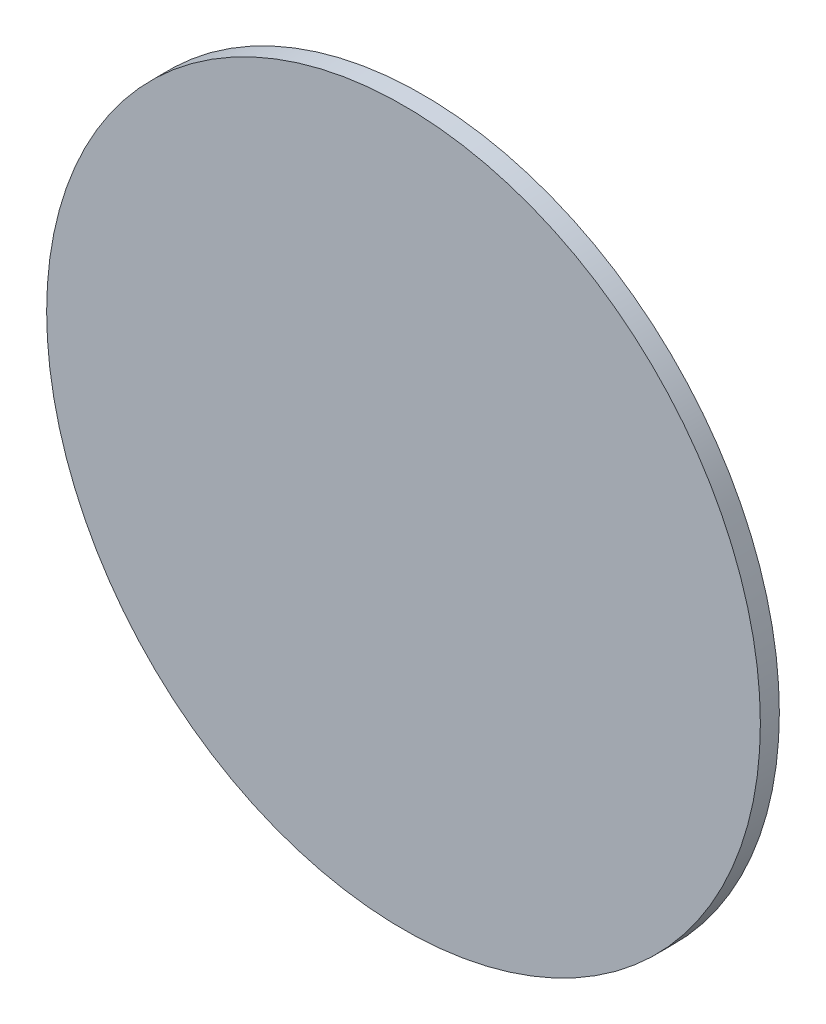
from build123d import *

# Parameters (mm, degrees)
SKETCH1_R           = 18.8
BOSS_EXTRUDE1_DEPTH = 1


with BuildPart() as part:
    # Sketch1 → Boss-Extrude1 (new body)
    with BuildSketch(Plane.XY):
        Circle(SKETCH1_R)
    extrude(amount=BOSS_EXTRUDE1_DEPTH)


solid = part.part
